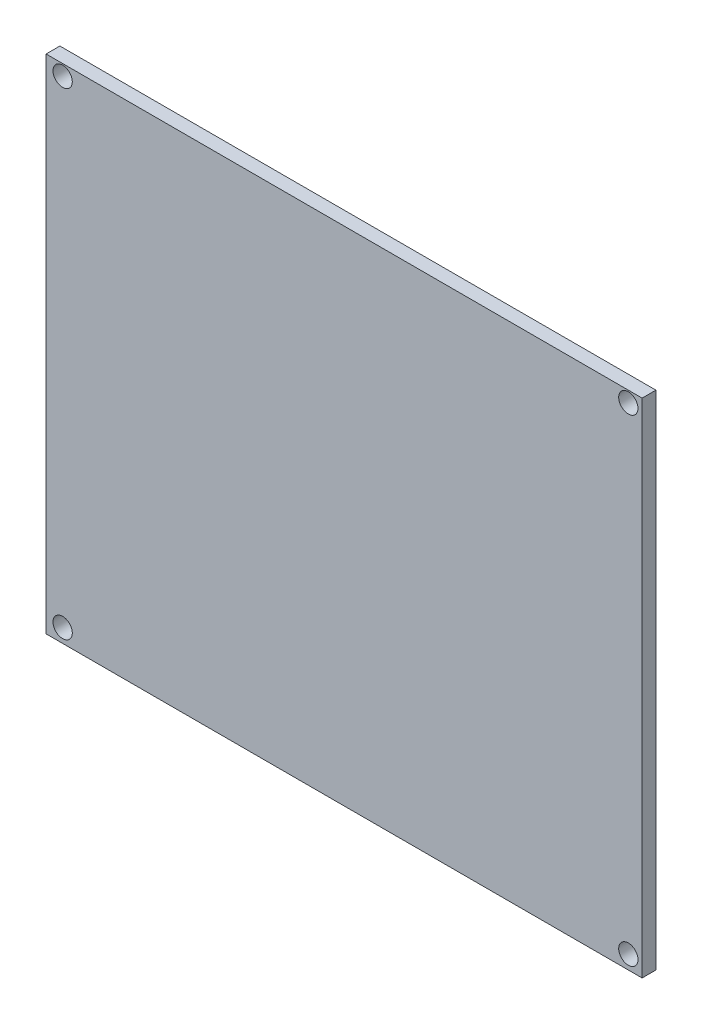
from build123d import *

# Parameters (mm, degrees)
ESQUISSE1_W             = 216
ESQUISSE1_H             = 182
BOSS_EXTRU_2_DEPTH      = 5
ESQUISSE2_R             = 3.5
ENL_V_MAT_EXTRU_1_DEPTH = 293.31996072


with BuildPart() as part:
    # Esquisse1 → Boss.-Extru.2 (new body)
    with BuildSketch(Plane.XY):
        with Locations((97.182692308, -117.149038462)):
            Rectangle(ESQUISSE1_W, ESQUISSE1_H)
    extrude(amount=BOSS_EXTRU_2_DEPTH)

    # Esquisse2 → Enlèv. mat.-Extru.1 (cut, through all)
    with BuildSketch(Plane.XY.offset(5)):
        with Locations((200.182692308, -203.149038462)):
            Circle(ESQUISSE2_R)
        with Locations((-4.817307692, -203.149038462)):
            Circle(ESQUISSE2_R)
        with Locations((-4.817307692, -30.149038462)):
            Circle(ESQUISSE2_R)
        with Locations((200.182692308, -30.149038462)):
            Circle(ESQUISSE2_R)
    extrude(amount=-ENL_V_MAT_EXTRU_1_DEPTH, mode=Mode.SUBTRACT)


solid = part.part
